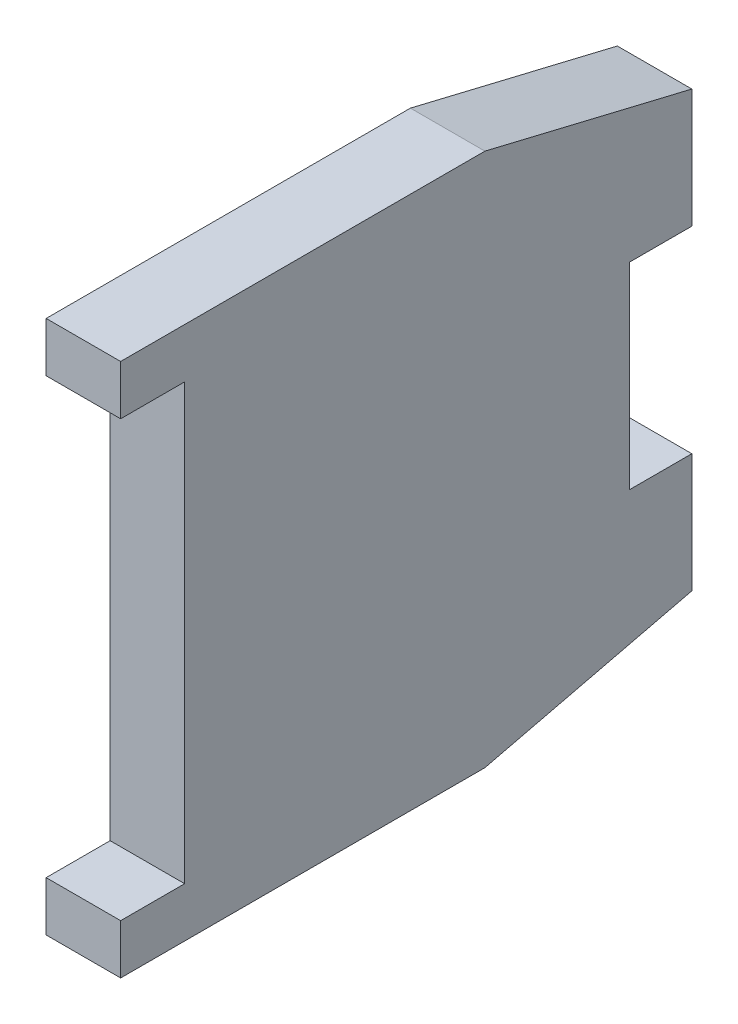
from build123d import *

# Parameters (mm, degrees)
EXTRUDE_1_DEPTH      = 3
EXTRUDE_1_DEPTH_BACK = 3


with BuildPart() as part:
    # 草图1 → 凸台-拉伸1 (new, two sides: drawn at the far end of the back side and taken through both)
    with BuildSketch(Plane(origin=(0, 0, 0), x_dir=(0, 0, -1), z_dir=(1, 0, 0)).offset(-EXTRUDE_1_DEPTH_BACK)):
        Polygon((0, 17.5), (0, 21.5), (29.3330418, 21.5), (46, 17.5), (46, 7.934061775), (40.962815164, 7.934061775), (40.962815164, -7.934061775), (46, -7.934061775), (46, -17.5), (29.3330418, -21.5), (0, -21.5), (0, -17.5), (5.153343524, -17.5), (5.153343524, 17.5), align=None)
    extrude(amount=EXTRUDE_1_DEPTH + EXTRUDE_1_DEPTH_BACK)


solid = part.part
